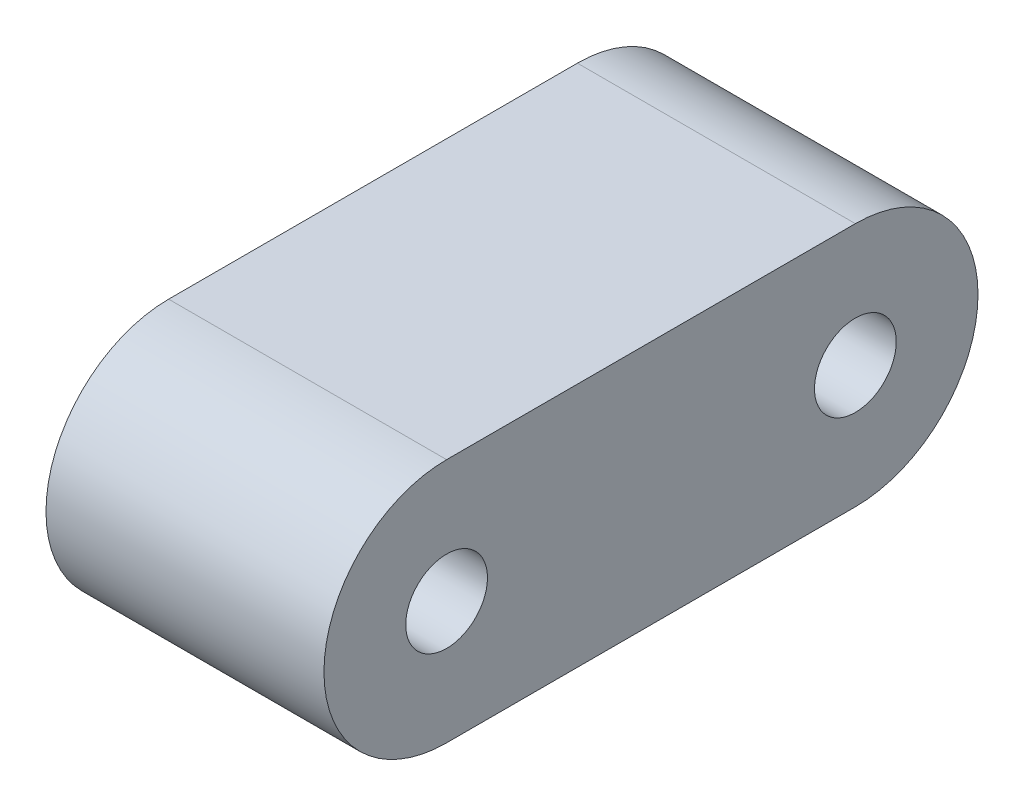
from build123d import *

# Parameters (mm, degrees)
CROQUIS1_R              = 2.5
SALIENTE_EXTRUIR1_DEPTH = 8.5


with BuildPart() as part:
    # Croquis1 → Saliente-Extruir1 (new, symmetric)
    with BuildSketch(Plane(origin=(0, 0, 0), x_dir=(0, 0, -1), z_dir=(1, 0, 0))):
        with BuildLine():
            Line((-12.5, 7.5), (12.5, 7.5))
            ThreePointArc((12.5, 7.5), (20, 0), (12.5, -7.5))
            Line((12.5, -7.5), (-12.5, -7.5))
            ThreePointArc((-12.5, -7.5), (-20, 0), (-12.5, 7.5))
        make_face()
        with Locations((-12.5, 0)):
            Circle(CROQUIS1_R, mode=Mode.SUBTRACT)
        with Locations((12.5, 0)):
            Circle(CROQUIS1_R, mode=Mode.SUBTRACT)
    extrude(amount=SALIENTE_EXTRUIR1_DEPTH, both=True)


solid = part.part
